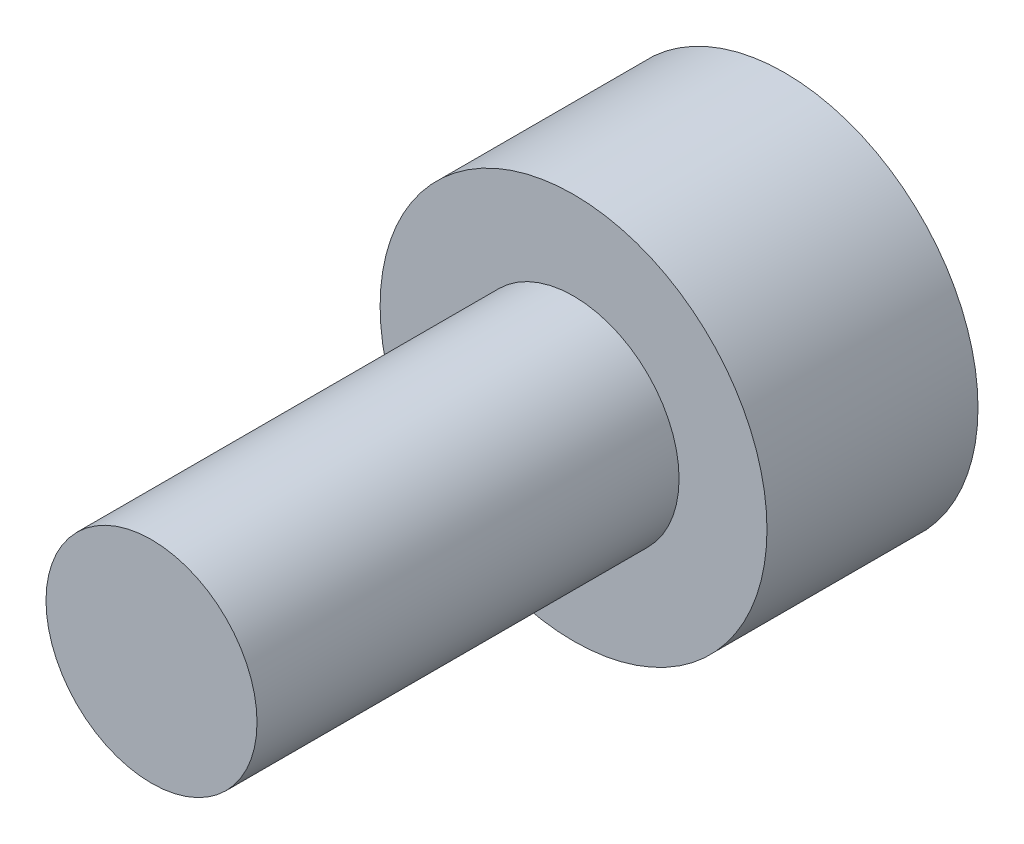
from build123d import *

# Parameters (mm, degrees)
CABEZA_START            = -3
CROQUIS1_R              = 2.75
CABEZA_DEPTH            = 3
CROQUIS2_R              = 1.5
CUERPO_DEPTH            = 6
HEXAGONO_INTERIOR_START = -3
HEXAGONO_INTERIOR_DEPTH = 1.3


with BuildPart() as part:
    # Croquis1 → Cabeza (new body)
    with BuildSketch(Plane.XY.offset(CABEZA_START)):
        Circle(CROQUIS1_R)
    extrude(amount=CABEZA_DEPTH)

    # Croquis2 → Cuerpo (add)
    with BuildSketch(Plane.XY):
        Circle(CROQUIS2_R)
    extrude(amount=CUERPO_DEPTH)

    # Croquis3 → Hexagono_interior (cut)
    with BuildSketch(Plane.XY.offset(HEXAGONO_INTERIOR_START)):
        Polygon((1.443375673, 0), (0.721687836, 1.25), (-0.721687836, 1.25), (-1.443375673, 0), (-0.721687836, -1.25), (0.721687836, -1.25), align=None)
    extrude(amount=HEXAGONO_INTERIOR_DEPTH, mode=Mode.SUBTRACT)


solid = part.part
